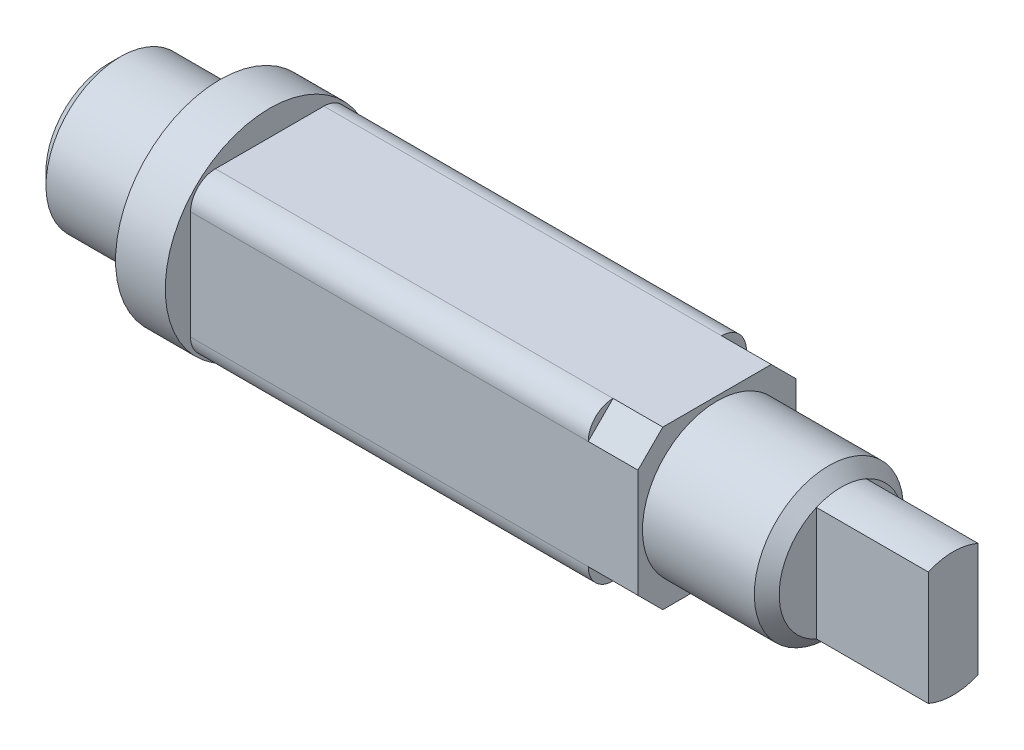
from build123d import *

# Parameters (mm, degrees)
EXTRUDE_1_DEPTH = 16
EXTRUDE_2_DEPTH = 2
EXTRUDE_3_DEPTH = 5


with BuildPart() as part:
    # 草图1 → 旋转1 (revolve)
    with BuildSketch(Plane.XY):
        Polygon((0, 3), (4, 3), (4, 4.2), (6, 4.2), (6, 0), (0, 0), (-0.5, 0), (-0.5, 2.5), align=None)
    revolve(axis=Axis((6, 0, 0), (-1, 0, 0)))

    # 草图2 → 凸台-拉伸1 (add)
    with BuildSketch(Plane(origin=(6, 0, 0), x_dir=(0, 0, -1), z_dir=(1, 0, 0))):
        with BuildLine():
            Line((-2.181980515, 3.181980515), (2.181980515, 3.181980515))
            ThreePointArc((2.181980515, 3.181980515), (2.889087297, 2.889087297), (3.181980515, 2.181980515))
            Line((3.181980515, 2.181980515), (3.181980515, -2.181980515))
            ThreePointArc((3.181980515, -2.181980515), (2.889087297, -2.889087297), (2.181980515, -3.181980515))
            Line((2.181980515, -3.181980515), (-2.181980515, -3.181980515))
            ThreePointArc((-2.181980515, -3.181980515), (-2.889087297, -2.889087297), (-3.181980515, -2.181980515))
            Line((-3.181980515, -2.181980515), (-3.181980515, 2.181980515))
            ThreePointArc((-3.181980515, 2.181980515), (-2.889087297, 2.889087297), (-2.181980515, 3.181980515))
        make_face()
    extrude(amount=EXTRUDE_1_DEPTH)

    # 草图3 → 凸台-拉伸2 (add)
    with BuildSketch(Plane(origin=(22, 0, 0), x_dir=(0, 0, -1), z_dir=(1, 0, 0))):
        Polygon((3.181980515, 2.181980515), (2.181980515, 3.181980515), (-2.181980515, 3.181980515), (-3.181980515, 2.181980515), (-3.181980515, -2.181980515), (-2.181980515, -3.181980515), (2.181980515, -3.181980515), (3.181980515, -2.181980515), align=None)
    extrude(amount=EXTRUDE_2_DEPTH)

    # 草图4 → 旋转2 (revolve)
    with BuildSketch(Plane.XY):
        Polygon((28.5, 3), (29, 2.5), (29, 0), (24, 0), (24, 3), align=None)
    revolve(axis=Axis((29, 0, 0), (-1, 0, 0)))

    # 草图5 → 凸台-拉伸3 (add)
    with BuildSketch(Plane(origin=(28.5, 0, 0), x_dir=(0, 0, -1), z_dir=(1, 0, 0))):
        with BuildLine():
            Line((-1, -1.791287847), (-1, -2.291287847))
            ThreePointArc((-1, -2.291287847), (0, -2.5), (1, -2.291287847))
            Line((1, -2.291287847), (1, -1.791287847))
            Line((1, -1.791287847), (1, 1.791287847))
            Line((1, 1.791287847), (1, 2.291287847))
            ThreePointArc((1, 2.291287847), (0, 2.5), (-1, 2.291287847))
            Line((-1, 2.291287847), (-1, 1.791287847))
            Line((-1, 1.791287847), (-1, -1.791287847))
        make_face()
    extrude(amount=EXTRUDE_3_DEPTH)


solid = part.part
